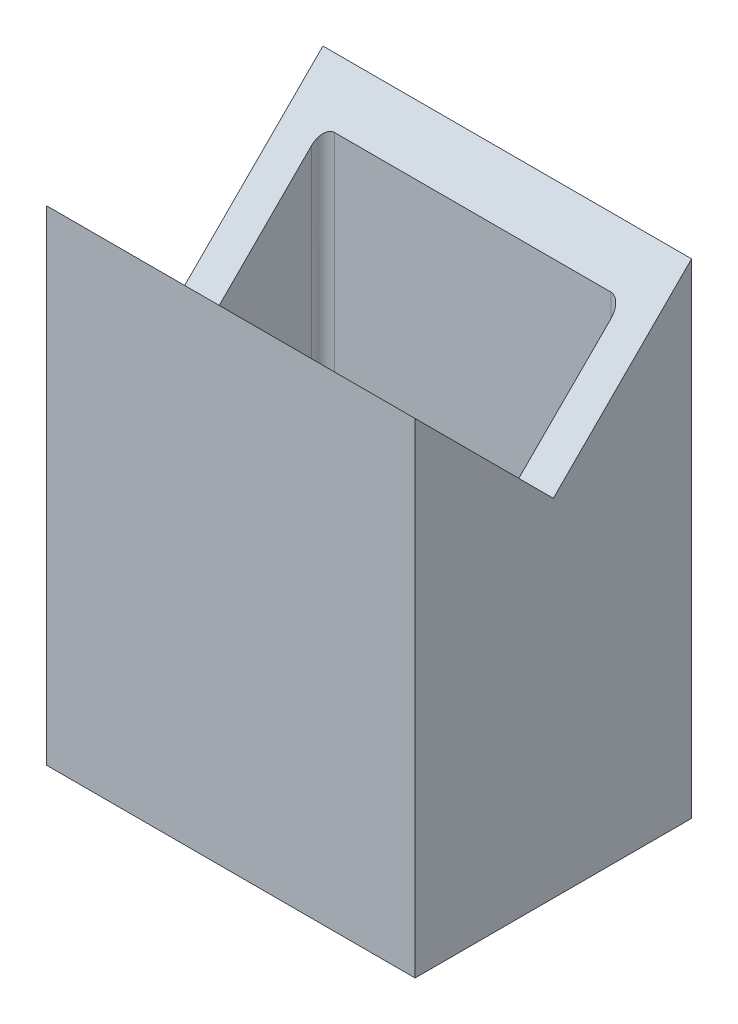
from build123d import *

# Parameters (mm, degrees)
BOSS_EXTRUDE1_DEPTH = 508
CUT_EXTRUDE7_REACH  = 521.459


with BuildPart() as part:
    # Sketch1 → Boss-Extrude1 (new body)
    with BuildSketch(Plane(origin=(0, 0, 0), x_dir=(1, 0, 0), z_dir=(0, 1, 0))):
        Polygon((-52.613166046, -38.1), (52.613166046, -38.1), (50.8, -38.1), (50.8, -0.977324315), (50.8, 0.977324315), (50.8, 38.1), (39.913166046, 38.1), (-39.913166046, 38.1), (-50.8, 38.1), (-50.8, -24.422675685), (-50.8, 24.422675685), (-50.8, -38.1), align=None)
        with BuildLine():
            Line((-38.1, -28.575), (38.1, -28.575))
            ThreePointArc((38.1, -28.575), (40.34506403, -27.64506403), (41.275, -25.4))
            Line((41.275, -25.4), (41.275, 25.4))
            ThreePointArc((41.275, 25.4), (40.34506403, 27.64506403), (38.1, 28.575))
            Line((38.1, 28.575), (-38.1, 28.575))
            ThreePointArc((-38.1, 28.575), (-40.34506403, 27.64506403), (-41.275, 25.4))
            Line((-41.275, 25.4), (-41.275, -25.4))
            ThreePointArc((-41.275, -25.4), (-40.34506403, -27.64506403), (-38.1, -28.575))
        make_face(mode=Mode.SUBTRACT)
    extrude(amount=BOSS_EXTRUDE1_DEPTH)

    # Cut-Extrude7: up to this face of the body (flat: up to its plane)
    cut_extrude7_end = Plane(part.part.faces().sort_by_distance((-50.8, 254, 0))[0])
    # Sketch8 → Cut-Extrude7 (cut, up to the picked face)
    with BuildSketch(Plane(origin=(50.8, 0, 0), x_dir=(0, 0, -1), z_dir=(1, 0, 0)), mode=Mode.PRIVATE) as cut_extrude7_sk1:
        Polygon((-38.1, 133.5369186), (0, 95.4369186), (38.1, 133.5369186), (38.1, 508), (-38.1, 508), align=None)
    cut_extrude7_tool1 = split(extrude(cut_extrude7_sk1.sketch, amount=-CUT_EXTRUDE7_REACH, mode=Mode.PRIVATE), bisect_by=cut_extrude7_end, keep=Keep.BOTH, mode=Mode.PRIVATE)
    add(cut_extrude7_tool1.solids().sort_by(Axis((50.8, 311.089757, 0), (-1, 0, 0)))[0], mode=Mode.SUBTRACT)


solid = part.part
